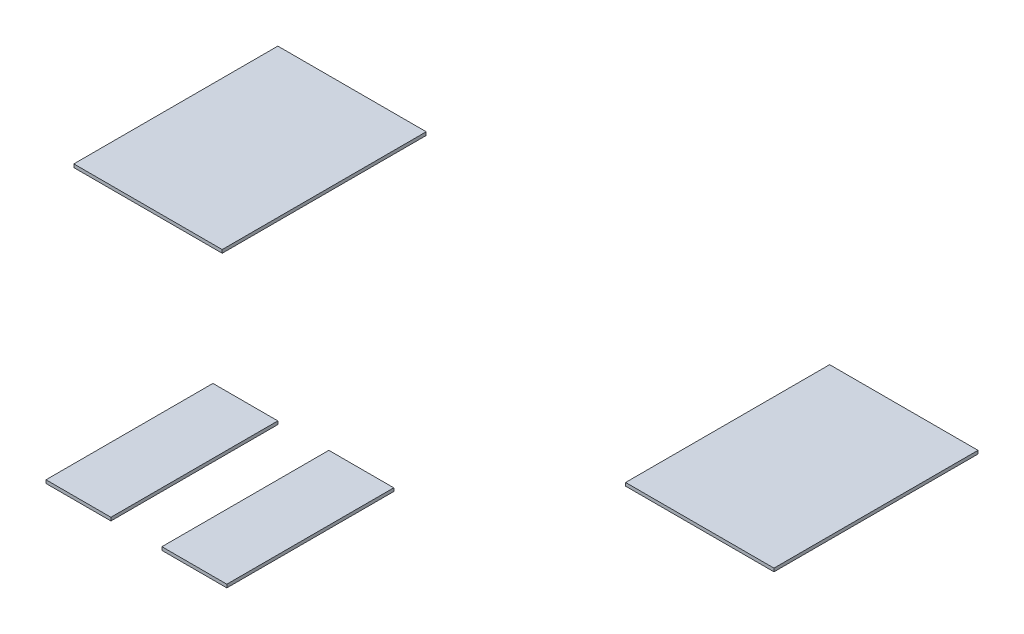
from build123d import *

# Parameters (mm, degrees)
SKETCH1_W             = 0.7
SKETCH1_H             = 1.8
BOSS_EXTRUDE1_DEPTH   = 0.035
BOSS_EXTRUDE1_2_DEPTH = 0.035
SKETCH1_W_2           = 1.6
SKETCH1_H_2           = 2.2
BOSS_EXTRUDE1_3_DEPTH = 0.035
BOSS_EXTRUDE1_4_DEPTH = 0.035


with BuildPart() as part:
    # Sketch1 → Boss-Extrude1 (new body)
    with BuildSketch(Plane(origin=(0, 0, 0), x_dir=(1, 0, 0), z_dir=(0, 1, 0))):
        with Locations((-0.625, 0.9)):
            Rectangle(SKETCH1_W, SKETCH1_H)
    extrude(amount=BOSS_EXTRUDE1_DEPTH)


with BuildPart() as body_2:
    # Sketch1 → Boss-Extrude1 2 (new body)
    with BuildSketch(Plane(origin=(0, 0, 0), x_dir=(1, 0, 0), z_dir=(0, 1, 0))):
        with Locations((0.625, 0.9)):
            Rectangle(SKETCH1_W, SKETCH1_H)
    extrude(amount=BOSS_EXTRUDE1_2_DEPTH)


with BuildPart() as body_3:
    # Sketch1 → Boss-Extrude1 3 (new body)
    with BuildSketch(Plane(origin=(0, 0, 0), x_dir=(1, 0, 0), z_dir=(0, 1, 0))):
        with Locations((2.975, 4.2)):
            Rectangle(SKETCH1_W_2, SKETCH1_H_2)
    extrude(amount=BOSS_EXTRUDE1_3_DEPTH)


with BuildPart() as body_4:
    # Sketch1 → Boss-Extrude1 4 (new body)
    with BuildSketch(Plane(origin=(0, 0, 0), x_dir=(1, 0, 0), z_dir=(0, 1, 0))):
        with Locations((-2.975, 4.2)):
            Rectangle(SKETCH1_W_2, SKETCH1_H_2)
    extrude(amount=BOSS_EXTRUDE1_4_DEPTH)


solid = Compound([part.part, body_2.part, body_3.part, body_4.part])
